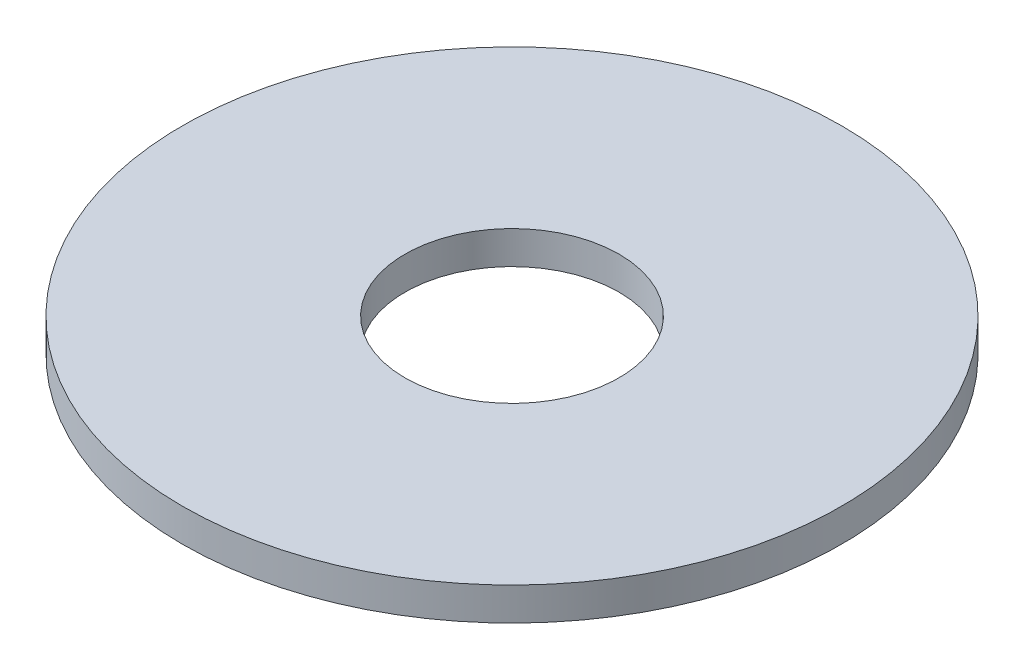
from build123d import *

# Parameters (mm, degrees)
SKETCH_1_R      = 10
SKETCH_1_R_2    = 3.25
EXTRUDE_1_DEPTH = 1


with BuildPart() as part:
    # Эскиз1 → Бобышка-Вытянуть1 (new body)
    with BuildSketch(Plane(origin=(0, 0, 0), x_dir=(1, 0, 0), z_dir=(0, 1, 0))):
        with Locations(Location((0, 0, 0), (0, 0, 270))):
            Circle(SKETCH_1_R)
        with Locations(Location((0, 0, 0), (0, 0, 270))):
            Circle(SKETCH_1_R_2, mode=Mode.SUBTRACT)
    extrude(amount=EXTRUDE_1_DEPTH)


solid = part.part
